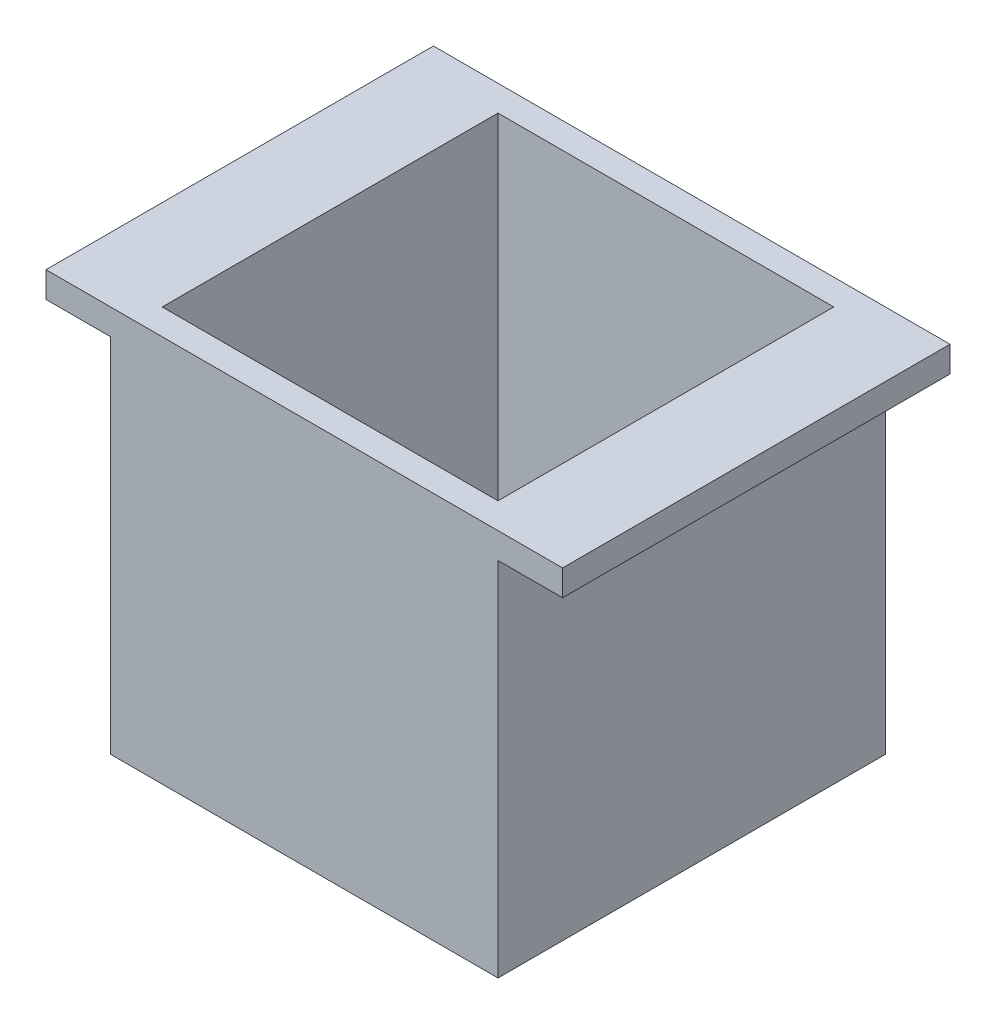
from build123d import *

# Parameters (mm, degrees)
P_IDAT_VYSUNUT_M1_DEPTH  = 30
SKICA2_W                 = 26
SKICA2_H                 = 26
ODEBRAT_VYSUNUT_M1_DEPTH = 28


with BuildPart() as part:
    # Skica1 → Přidat vysunutím1 (new body)
    with BuildSketch(Plane.XY):
        Polygon((0, 0), (0, 28), (-5, 28), (-5, 30), (35, 30), (35, 28), (30, 28), (30, 0), align=None)
    extrude(amount=P_IDAT_VYSUNUT_M1_DEPTH)

    # Skica2 → Odebrat vysunutím1 (cut)
    with BuildSketch(Plane(origin=(0, 30, 0), x_dir=(1, 0, 0), z_dir=(0, 1, 0))):
        with Locations((15, -15)):
            Rectangle(SKICA2_W, SKICA2_H)
    extrude(amount=-ODEBRAT_VYSUNUT_M1_DEPTH, mode=Mode.SUBTRACT)


solid = part.part
